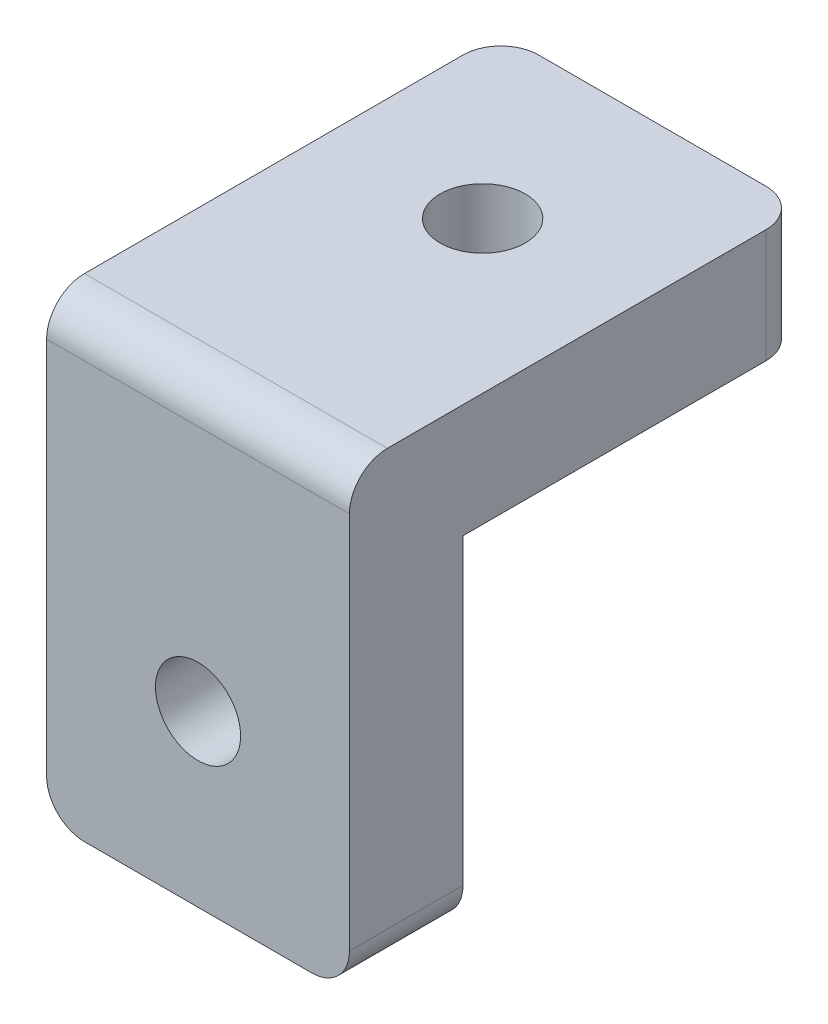
from build123d import *

# Parameters (mm, degrees)
SALIENTE_EXTRUIR1_DEPTH = 8
REDONDEO1_R             = 1
CROQUIS2_R              = 1.125
CORTAR_EXTRUIR1_DEPTH   = 18
CROQUIS3_R              = 1.125
CORTAR_EXTRUIR2_DEPTH   = 18
REDONDEO2_R             = 1


with BuildPart() as part:
    # Croquis1 → Saliente-Extruir1 (new body)
    with BuildSketch(Plane(origin=(0, 0, 0), x_dir=(0, 0, -1), z_dir=(1, 0, 0))):
        Polygon((0, 0), (0, 12), (12, 12), (12, 9), (3, 9), (3, 0), align=None)
    extrude(amount=SALIENTE_EXTRUIR1_DEPTH)

    # Redondeo1
    redondeo1_edges = [part.edges().sort_by_distance(p)[0] for p in [
        (8, 10.5, -12),
        (8, 0, -1.5),
        (0, 10.5, -12),
        (0, 0, -1.5),
    ]]
    fillet(redondeo1_edges, radius=REDONDEO1_R)

    # Croquis2 → Cortar-Extruir1 (cut, through all)
    with BuildSketch(Plane.XZ.offset(-9)):
        with Locations(Location((4, -7.519001503, 0), (0, 0, 270))):
            Circle(CROQUIS2_R)
    extrude(amount=-CORTAR_EXTRUIR1_DEPTH, mode=Mode.SUBTRACT)

    # Croquis3 → Cortar-Extruir2 (cut, through all)
    with BuildSketch(Plane(origin=(0, 0, -3), x_dir=(-1, 0, 0), z_dir=(0, 0, -1))):
        with Locations(Location((-4, 4.480998497, 0), (0, 0, 90))):
            Circle(CROQUIS3_R)
    extrude(amount=-CORTAR_EXTRUIR2_DEPTH, mode=Mode.SUBTRACT)

    # Redondeo2
    redondeo2_edges = [part.edges().sort_by_distance(p)[0] for p in [
        (4, 12, 0),
    ]]
    fillet(redondeo2_edges, radius=REDONDEO2_R)


solid = part.part
